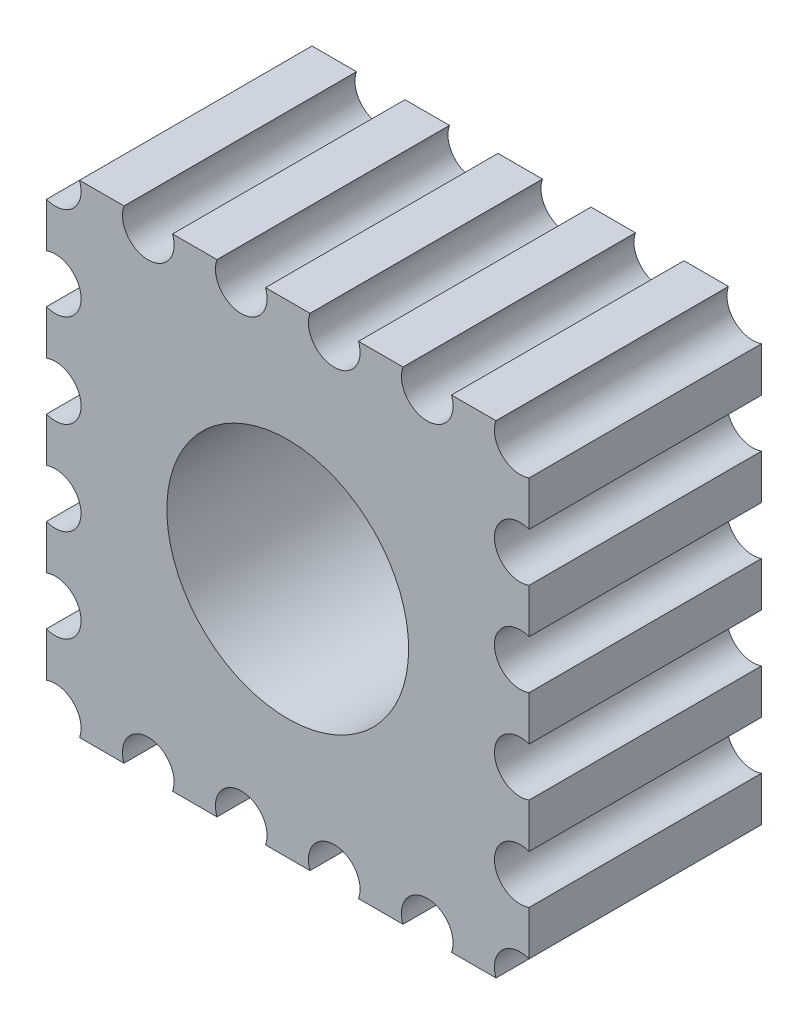
from build123d import *

# Parameters (mm, degrees)
SKETCH2_R           = 4.1
SKETCH2_R_2         = 2.6
BOSS_EXTRUDE1_DEPTH = 5


with BuildPart() as part:
    # Sketch2 → Boss-Extrude1 (new body)
    # profile 1 of 2: a face of its own
    with BuildSketch(Plane.XY):
        with BuildLine():
            ThreePointArc((-8.388352144, 2.232508627), (-7.643352144, 2.753972912), (-8.388352144, 3.275437196))
            Line((-8.388352144, 3.275437196), (-8.388352144, 4.232508627))
            ThreePointArc((-8.388352144, 4.232508627), (-7.805907881, 4.361528648), (-7.67688786, 4.943972912))
            Line((-7.67688786, 4.943972912), (-6.719816429, 4.943972912))
            ThreePointArc((-6.719816429, 4.943972912), (-6.198352144, 4.198972912), (-5.67688786, 4.943972912))
            Line((-5.67688786, 4.943972912), (-4.719816429, 4.943972912))
            ThreePointArc((-4.719816429, 4.943972912), (-4.198352144, 4.198972912), (-3.67688786, 4.943972912))
            Line((-3.67688786, 4.943972912), (-2.719816429, 4.943972912))
            ThreePointArc((-2.719816429, 4.943972912), (-2.198352144, 4.198972912), (-1.67688786, 4.943972912))
            Line((-1.67688786, 4.943972912), (-0.719816429, 4.943972912))
            ThreePointArc((-0.719816429, 4.943972912), (-0.198352144, 4.198972912), (0.32311214, 4.943972912))
            Line((0.32311214, 4.943972912), (1.280183571, 4.943972912))
            ThreePointArc((1.280183571, 4.943972912), (1.409203592, 4.361528648), (1.991647856, 4.232508627))
            Line((1.991647856, 4.232508627), (1.991647856, 3.275437196))
            ThreePointArc((1.991647856, 3.275437196), (1.246647856, 2.753972912), (1.991647856, 2.232508627))
            Line((1.991647856, 2.232508627), (1.991647856, 1.275437196))
            ThreePointArc((1.991647856, 1.275437196), (1.246647856, 0.753972912), (1.991647856, 0.232508627))
            Line((1.991647856, 0.232508627), (1.991647856, -0.724562804))
            ThreePointArc((1.991647856, -0.724562804), (1.246647856, -1.246027088), (1.991647856, -1.767491373))
            Line((1.991647856, -1.767491373), (1.991647856, -2.724562804))
            ThreePointArc((1.991647856, -2.724562804), (1.246647856, -3.246027088), (1.991647856, -3.767491373))
            Line((1.991647856, -3.767491373), (1.991647856, -4.724562804))
            ThreePointArc((1.991647856, -4.724562804), (1.409203592, -4.853582824), (1.280183571, -5.436027088))
            Line((1.280183571, -5.436027088), (0.32311214, -5.436027088))
            ThreePointArc((0.32311214, -5.436027088), (-0.198352144, -4.691027088), (-0.719816429, -5.436027088))
            Line((-0.719816429, -5.436027088), (-1.67688786, -5.436027088))
            ThreePointArc((-1.67688786, -5.436027088), (-2.198352144, -4.691027088), (-2.719816429, -5.436027088))
            Line((-2.719816429, -5.436027088), (-3.67688786, -5.436027088))
            ThreePointArc((-3.67688786, -5.436027088), (-4.198352144, -4.691027088), (-4.719816429, -5.436027088))
            Line((-4.719816429, -5.436027088), (-5.67688786, -5.436027088))
            ThreePointArc((-5.67688786, -5.436027088), (-6.198352144, -4.691027088), (-6.719816429, -5.436027088))
            Line((-6.719816429, -5.436027088), (-7.67688786, -5.436027088))
            ThreePointArc((-7.67688786, -5.436027088), (-7.805907881, -4.853582824), (-8.388352144, -4.724562804))
            Line((-8.388352144, -4.724562804), (-8.388352144, -3.767491373))
            ThreePointArc((-8.388352144, -3.767491373), (-7.643352144, -3.246027088), (-8.388352144, -2.724562804))
            Line((-8.388352144, -2.724562804), (-8.388352144, -1.767491373))
            ThreePointArc((-8.388352144, -1.767491373), (-7.643352144, -1.246027088), (-8.388352144, -0.724562804))
            Line((-8.388352144, -0.724562804), (-8.388352144, 0.232508627))
            ThreePointArc((-8.388352144, 0.232508627), (-7.643352144, 0.753972912), (-8.388352144, 1.275437196))
            Line((-8.388352144, 1.275437196), (-8.388352144, 2.232508627))
        make_face()
        with Locations((-3.198352144, -0.246027088)):
            Circle(SKETCH2_R, mode=Mode.SUBTRACT)
    # profile 2 of 2: a face of its own
    with BuildSketch(Plane.XY):
        with Locations((-3.198352144, -0.246027088)):
            Circle(SKETCH2_R)
        with Locations((-3.198352144, -0.246027088)):
            Circle(SKETCH2_R_2, mode=Mode.SUBTRACT)
    extrude(amount=BOSS_EXTRUDE1_DEPTH)


solid = part.part
